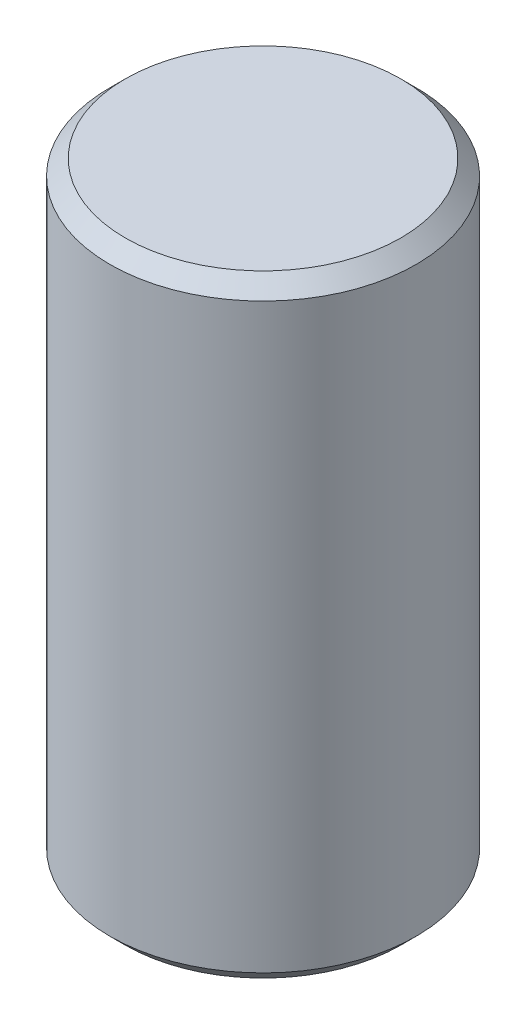
from build123d import *

# Parameters (mm, degrees)
SKETCH1_R           = 2.5
BOSS_EXTRUDE1_DEPTH = 10
CHAMFER1_SIZE       = 0.25


with BuildPart() as part:
    # Sketch1 → Boss-Extrude1 (new body)
    with BuildSketch(Plane(origin=(0, 0, 0), x_dir=(1, 0, 0), z_dir=(0, 1, 0))):
        with Locations(Location((0, 0, 0), (0, 0, 270))):
            Circle(SKETCH1_R)
    extrude(amount=BOSS_EXTRUDE1_DEPTH)

    # Chamfer1
    chamfer1_edges = [part.edges().sort_by_distance(p)[0] for p in [
        (0, 0, -2.5),
        (0, 10, -2.5),
    ]]
    chamfer(chamfer1_edges, length=CHAMFER1_SIZE)


solid = part.part
